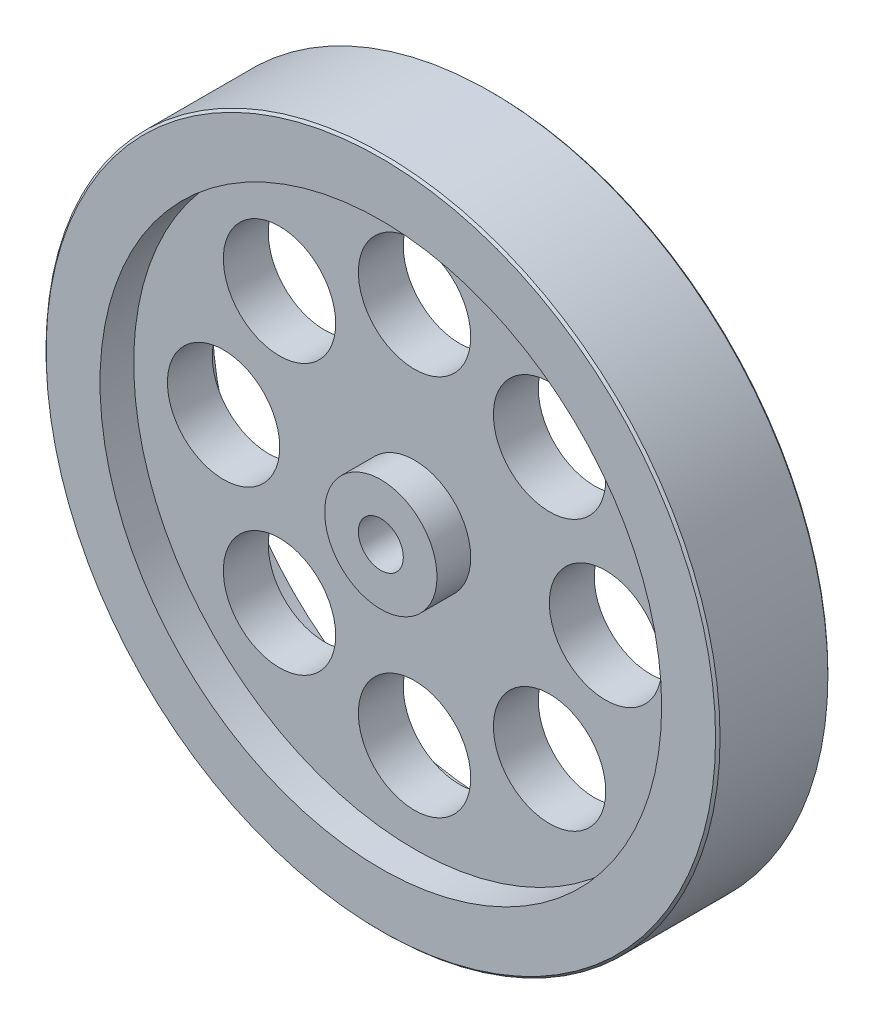
from build123d import *

# Parameters (mm, degrees)
SKETCH1_R               = 30
BOSS_EXTRUDE1_DEPTH     = 5
SKETCH2_R               = 25
CUT_EXTRUDE1_DEPTH      = 3
CUT_EXTRUDE2_DEPTH      = 44
CUT_EXTRUDE2_DEPTH_BACK = 44
SKETCH3_R               = 5
SKETCH4_R               = 5
BOSS_EXTRUDE2_DEPTH     = 3
CHAMFER1_SIZE           = 0.2


with BuildPart() as part:
    # Sketch1 → Boss-Extrude1 (new, symmetric)
    with BuildSketch(Plane.XY):
        Circle(SKETCH1_R)
    extrude(amount=BOSS_EXTRUDE1_DEPTH, both=True)

    # Sketch2 → Cut-Extrude1 (cut)
    with BuildSketch(Plane.XY.offset(5)):
        Circle(SKETCH2_R)
    cut_extrude1 = extrude(amount=-CUT_EXTRUDE1_DEPTH, mode=Mode.SUBTRACT)

    # Mirror1: Cut-Extrude1 across plane
    add(cut_extrude1.mirror(Plane.XY), mode=Mode.SUBTRACT)

    # Sketch3 → Cut-Extrude2 (cut, two sides: drawn at the far end of the back side and taken through both)
    with BuildSketch(Plane.XY.offset(2).offset(-CUT_EXTRUDE2_DEPTH_BACK)):
        with Locations((0, 17)):
            Circle(SKETCH3_R)
        with Locations((12.02081528, 12.02081528)):
            Circle(SKETCH3_R)
        with Locations((17, 0)):
            Circle(SKETCH3_R)
        with Locations((12.02081528, -12.02081528)):
            Circle(SKETCH3_R)
        with Locations((0, -17)):
            Circle(SKETCH3_R)
        with Locations((-12.02081528, -12.02081528)):
            Circle(SKETCH3_R)
        with Locations((-17, 0)):
            Circle(SKETCH3_R)
        with Locations((-12.02081528, 12.02081528)):
            Circle(SKETCH3_R)
    extrude(amount=CUT_EXTRUDE2_DEPTH + CUT_EXTRUDE2_DEPTH_BACK, mode=Mode.SUBTRACT)

    # Sketch4 → Boss-Extrude2 (add)
    with BuildSketch(Plane.XY.offset(2)):
        Circle(SKETCH4_R)
    boss_extrude2 = extrude(amount=BOSS_EXTRUDE2_DEPTH)

    # Mirror2: Boss-Extrude2 across plane
    add(boss_extrude2.mirror(Plane.XY))

    # Sketch5 → Cut-Revolve1 (revolve, cut)
    with BuildSketch(Plane(origin=(0, 0, 0), x_dir=(0, 0, -1), z_dir=(1, 0, 0)), mode=Mode.PRIVATE) as cut_revolve1_sk:
        Polygon((-5, 0), (5, 0), (5, 3), (3.5, 1.5), (1, 1.5), (1, 2), (-5, 2), align=None)
    revolve(cut_revolve1_sk.sketch.rotate(Axis((0, 0, 5), (0, 0, -1)), 90), axis=Axis((0, 0, 5), (0, 0, -1)), mode=Mode.SUBTRACT)

    # Chamfer1
    chamfer1_edges = [part.edges().sort_by_distance(p)[0] for p in [
        (-30, 0, -5),
        (-30, 0, 5),
    ]]
    chamfer(chamfer1_edges, length=CHAMFER1_SIZE)


solid = part.part
